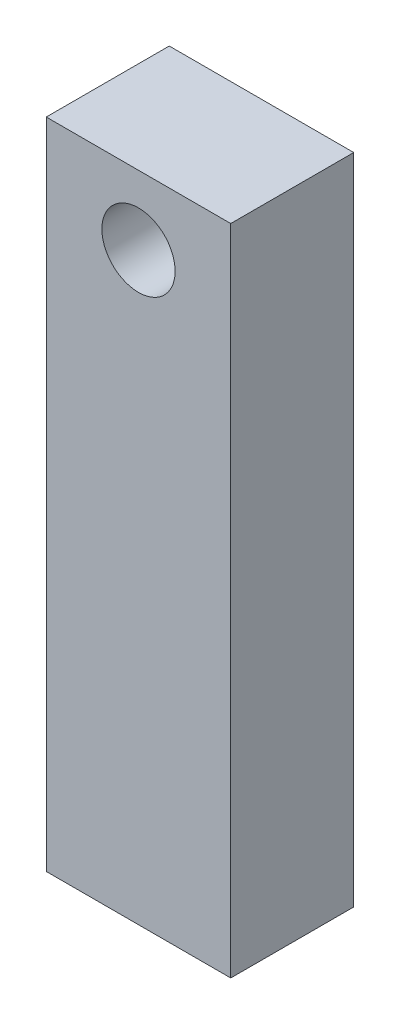
from build123d import *

# Parameters (mm, degrees)
SKETCH1_W           = 24
SKETCH1_H           = 16
BOSS_EXTRUDE1_DEPTH = 85
SKETCH2_R           = 4.7625
CUT_EXTRUDE1_DEPTH  = 10


with BuildPart() as part:
    # Sketch1 → Boss-Extrude1 (new body)
    with BuildSketch(Plane(origin=(0, 0, 0), x_dir=(1, 0, 0), z_dir=(0, 1, 0))):
        Rectangle(SKETCH1_W, SKETCH1_H)
    extrude(amount=BOSS_EXTRUDE1_DEPTH)

    # Sketch2 → Cut-Extrude1 (cut, symmetric)
    with BuildSketch(Plane.XY):
        with Locations((0, 76)):
            Circle(SKETCH2_R)
    extrude(amount=CUT_EXTRUDE1_DEPTH, both=True, mode=Mode.SUBTRACT)


solid = part.part
